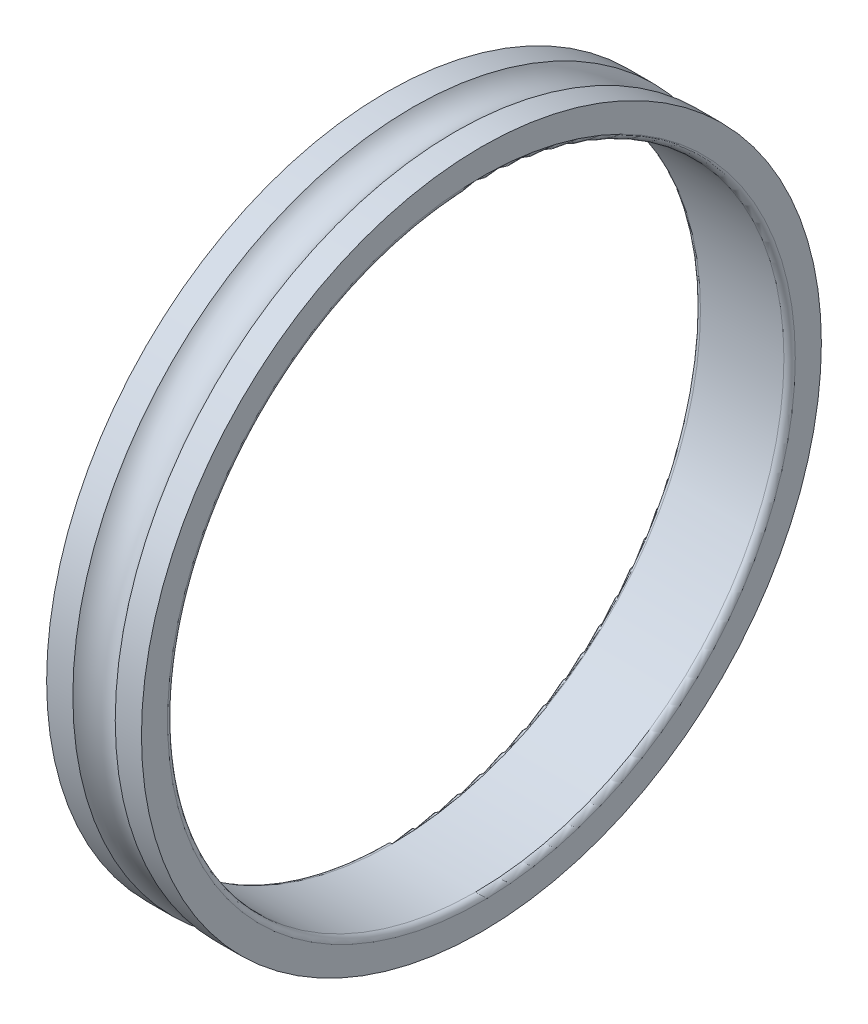
from build123d import *


with BuildPart() as part:
    # 草图1 → 旋转1 (revolve)
    with BuildSketch(Plane.XY, mode=Mode.PRIVATE) as revolve_1_sk:
        with BuildLine():
            Line((0, 35.85), (0, 33.1))
            ThreePointArc((0, 33.1), (0.175735931, 32.675735931), (0.6, 32.5))
            Line((0.6, 32.5), (9.4, 32.5))
            ThreePointArc((9.4, 32.5), (9.824264069, 32.675735931), (10, 33.1))
            Line((10, 33.1), (10, 35.85))
            Line((10, 35.85), (7.23490134, 35.85))
            ThreePointArc((7.23490134, 35.85), (5, 34.722), (2.76509866, 35.85))
            Line((2.76509866, 35.85), (0, 35.85))
        make_face()
    revolve(revolve_1_sk.sketch.rotate(Axis((-0.001266185, 0, 0), (1, 0, 0)), 270), axis=Axis((-0.001266185, 0, 0), (1, 0, 0)))


solid = part.part
